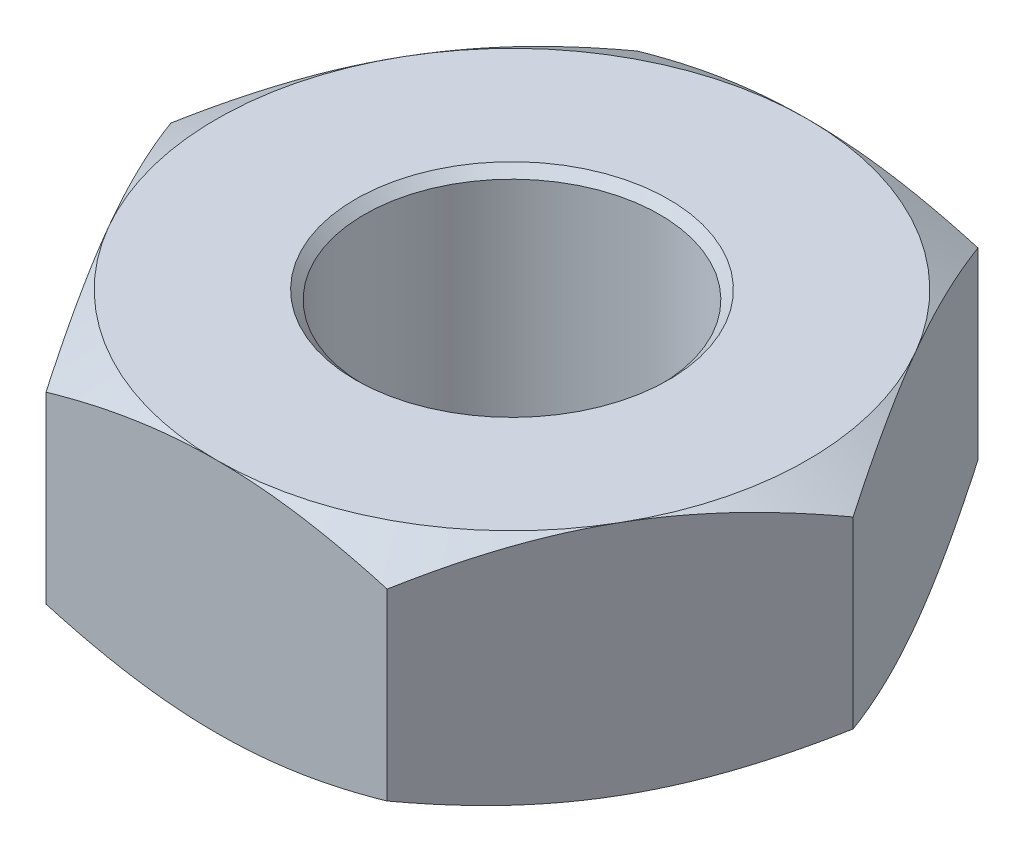
from build123d import *

# Parameters (mm, degrees)
SKETCH2_R           = 1.25
BOSS_EXTRUDE1_DEPTH = 2
SKETCH3_OUTSIDE_W   = 20.612
SKETCH3_OUTSIDE_H   = 19.838
SKETCH3_OUTSIDE_R   = 2.5
CUT_EXTRUDE1_DEPTH  = 3.25
CUT_EXTRUDE1_DRAFT  = 60
SKETCH4_OUTSIDE_W   = 20.612
SKETCH4_OUTSIDE_H   = 19.838
SKETCH4_OUTSIDE_R   = 2.5
CUT_EXTRUDE2_DEPTH  = 3.25
CUT_EXTRUDE2_DRAFT  = -60
CHAMFER1_SIZE       = 0.075


with BuildPart() as part:
    # Sketch2 → Boss-Extrude1 (new body)
    with BuildSketch(Plane(origin=(0, 0, 0), x_dir=(1, 0, 0), z_dir=(0, 1, 0))):
        Polygon((2.886751346, 0), (1.443375673, 2.5), (-1.443375673, 2.5), (-2.886751346, 0), (-1.443375673, -2.5), (1.443375673, -2.5), align=None)
        with Locations(Location((0, 0, 0), (0, 0, 270))):
            Circle(SKETCH2_R, mode=Mode.SUBTRACT)
    extrude(amount=BOSS_EXTRUDE1_DEPTH)


with BuildPart() as cut_extrude1_tool:
    # Sketch3 outside → Cut-Extrude1 (with draft: the straight prism first)
    with BuildSketch(Plane(origin=(0, 0, 0), x_dir=(1, 0, 0), z_dir=(0, 1, 0))):
        Rectangle(SKETCH3_OUTSIDE_W, SKETCH3_OUTSIDE_H)
        Circle(SKETCH3_OUTSIDE_R, mode=Mode.SUBTRACT)
    extrude(amount=CUT_EXTRUDE1_DEPTH)
    # Cut-Extrude1: the draft: its side faces are tilted about the plane it starts from
    cut_extrude1_sides = [cut_extrude1_tool.faces().sort_by_distance(p)[0] for p in [
        (0, 1.625, 9.919),
        (10.306, 1.625, 0),
        (0, 1.625, -9.919),
        (-10.306, 1.625, 0),
        (-2.5, 1.625, 0),
    ]]
    draft(cut_extrude1_sides, Plane(origin=(0, 0, 0), x_dir=(1, 0, 0), z_dir=(0, 1, 0)), CUT_EXTRUDE1_DRAFT)


with BuildPart() as part_1:
    add(part.part)

    # Cut-Extrude1: cut by cut_extrude1_tool
    add(cut_extrude1_tool.part, mode=Mode.SUBTRACT)


with BuildPart() as cut_extrude2_tool:
    # Sketch4 outside → Cut-Extrude2 (with draft: the straight prism first)
    with BuildSketch(Plane(origin=(0, 2, 0), x_dir=(1, 0, 0), z_dir=(0, 1, 0))):
        Rectangle(SKETCH4_OUTSIDE_W, SKETCH4_OUTSIDE_H)
        Circle(SKETCH4_OUTSIDE_R, mode=Mode.SUBTRACT)
    extrude(amount=-CUT_EXTRUDE2_DEPTH)
    # Cut-Extrude2: the draft: its side faces are tilted about the plane it starts from
    cut_extrude2_sides = [cut_extrude2_tool.faces().sort_by_distance(p)[0] for p in [
        (0, 0.375, 9.919),
        (10.306, 0.375, 0),
        (0, 0.375, -9.919),
        (-10.306, 0.375, 0),
        (-2.5, 0.375, 0),
    ]]
    draft(cut_extrude2_sides, Plane(origin=(0, 2, 0), x_dir=(1, 0, 0), z_dir=(0, 1, 0)), CUT_EXTRUDE2_DRAFT)


with BuildPart() as part_2:
    add(part_1.part)

    # Cut-Extrude2: cut by cut_extrude2_tool
    add(cut_extrude2_tool.part, mode=Mode.SUBTRACT)

    # Chamfer1
    chamfer1_edges = [part_2.edges().sort_by_distance(p)[0] for p in [
        (0, 0, -1.25),
        (0, 2, -1.25),
    ]]
    chamfer(chamfer1_edges, length=CHAMFER1_SIZE)


solid = part_2.part
